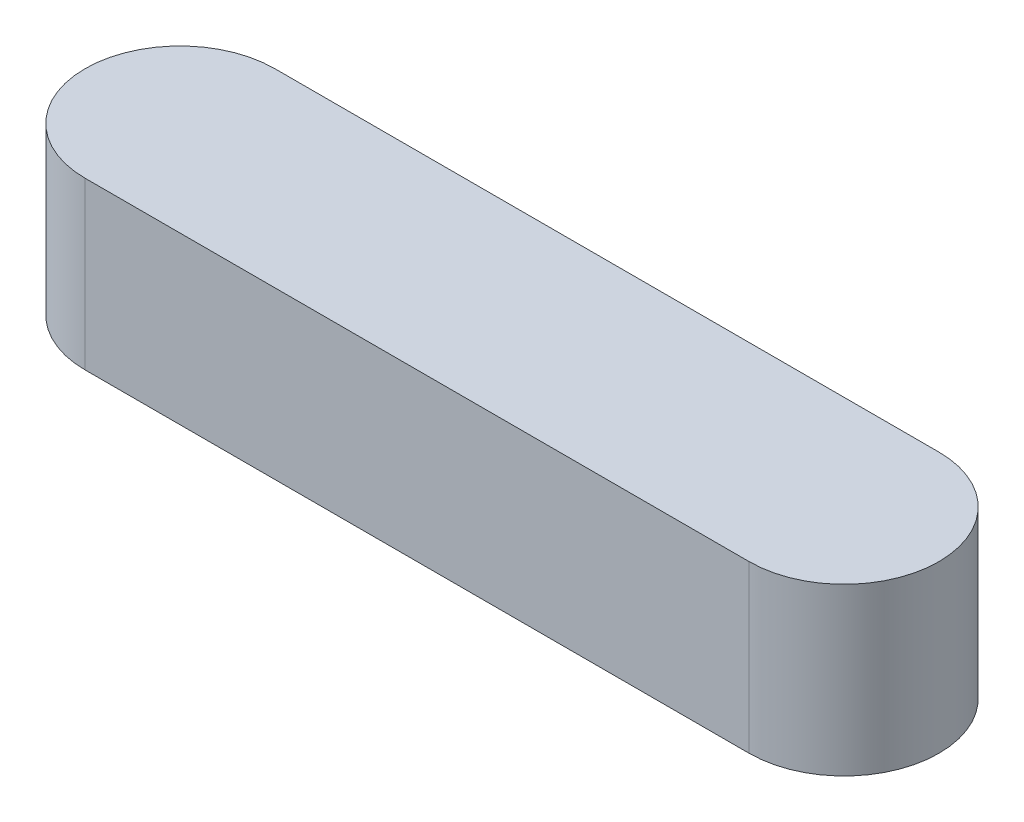
from build123d import *

# Parameters (mm, degrees)
EXTRUDE_1_DEPTH = 7


with BuildPart() as part:
    # Эскиз1 → Бобышка-Вытянуть1 (new body)
    with BuildSketch(Plane(origin=(0, 0, 0), x_dir=(1, 0, 0), z_dir=(0, 1, 0))):
        with BuildLine():
            Line((0, 4), (28, 4))
            ThreePointArc((28, 4), (32, 0), (28, -4))
            Line((28, -4), (0, -4))
            ThreePointArc((0, -4), (-4, 0), (0, 4))
        make_face()
    extrude(amount=EXTRUDE_1_DEPTH)


solid = part.part
